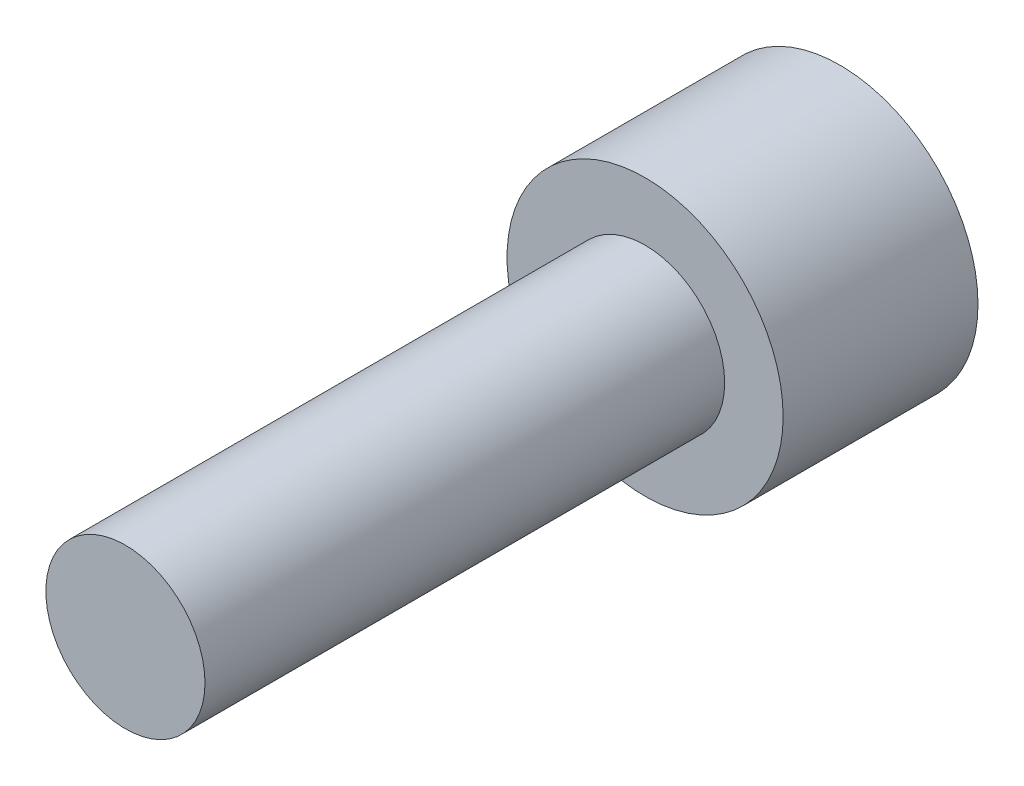
from build123d import *

# Parameters (mm, degrees)
SKIZZE1_R                       = 4.25
AUFSATZ_LINEAR_AUSTRAGEN1_DEPTH = 6
SKIZZE2_R                       = 2.45
AUFSATZ_LINEAR_AUSTRAGEN2_DEPTH = 16


with BuildPart() as part:
    # Skizze1 → Aufsatz-Linear austragen1 (new body)
    with BuildSketch(Plane.XY):
        Circle(SKIZZE1_R)
    extrude(amount=AUFSATZ_LINEAR_AUSTRAGEN1_DEPTH)

    # Skizze2 → Aufsatz-Linear austragen2 (add)
    with BuildSketch(Plane.XY.offset(6)):
        Circle(SKIZZE2_R)
    extrude(amount=AUFSATZ_LINEAR_AUSTRAGEN2_DEPTH)


solid = part.part
